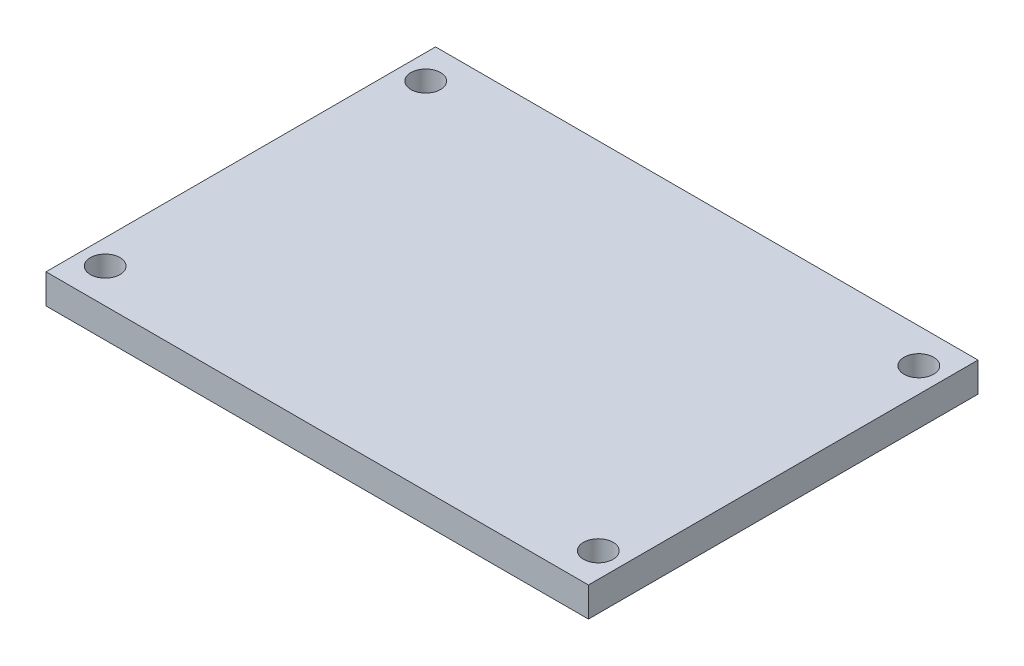
from build123d import *

# Parameters (mm, degrees)
SKETCH2_W               = 69.85
SKETCH2_H               = 50.165
BOSS_EXTRUDE1_DEPTH     = 3.81
CUT_EXTRUDE1_DEPTH      = 44.167158017
CUT_EXTRUDE1_DEPTH_BACK = 44.167158017
SKETCH3_R               = 1.905


with BuildPart() as part:
    # Sketch2 → Boss-Extrude1 (new body)
    with BuildSketch(Plane(origin=(0, 0, 0), x_dir=(1, 0, 0), z_dir=(0, 1, 0))):
        Rectangle(SKETCH2_W, SKETCH2_H)
    extrude(amount=BOSS_EXTRUDE1_DEPTH)

    # Sketch3 → Cut-Extrude1 (cut, two sides: drawn at the far end of the back side and taken through both)
    with BuildSketch(Plane(origin=(0, 3.81, 0), x_dir=(1, 0, 0), z_dir=(0, 1, 0)).offset(-CUT_EXTRUDE1_DEPTH_BACK)):
        with Locations(Location((-31.75, 20.6375, 0), (0, 0, 270))):
            Circle(SKETCH3_R)
        with Locations(Location((31.75, 20.6375, 0), (0, 0, 270))):
            Circle(SKETCH3_R)
        with Locations(Location((31.75, -20.6375, 0), (0, 0, 270))):
            Circle(SKETCH3_R)
        with Locations(Location((-31.75, -20.6375, 0), (0, 0, 270))):
            Circle(SKETCH3_R)
    extrude(amount=CUT_EXTRUDE1_DEPTH + CUT_EXTRUDE1_DEPTH_BACK, mode=Mode.SUBTRACT)


solid = part.part
